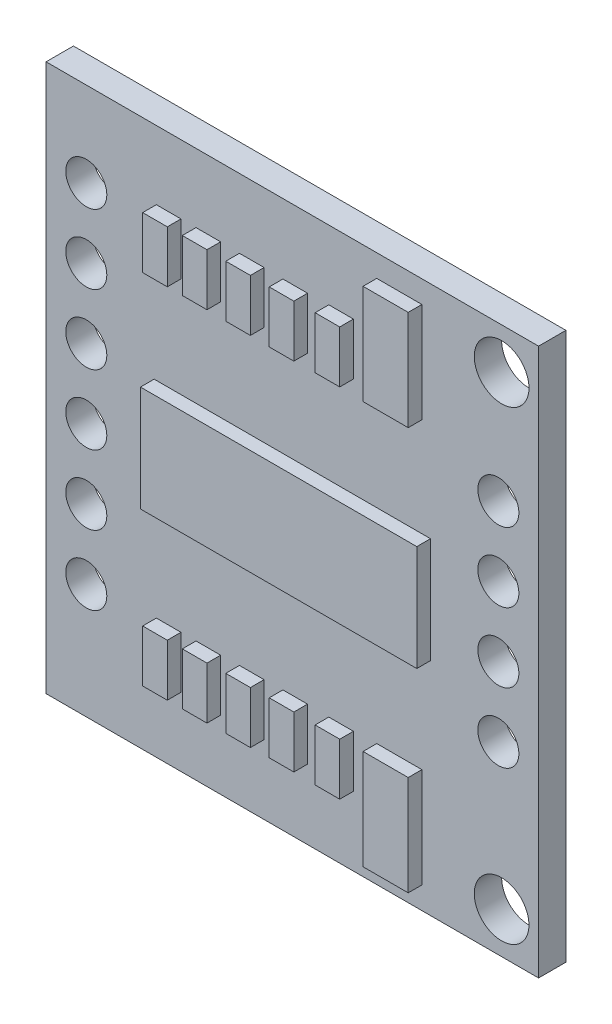
from build123d import *

# Parameters (mm, degrees)
SKETCH1_W           = 18
SKETCH1_H           = 20
SKETCH1_R           = 1
BOSS_EXTRUDE1_DEPTH = 1
SKETCH2_R           = 0.75
CUT_EXTRUDE1_DEPTH  = 1
SKETCH3_W           = 10.1
SKETCH3_H           = 3.86
BOSS_EXTRUDE3_DEPTH = 0.5
SKETCH4_W           = 0.9
SKETCH4_H           = 1.9
SKETCH4_W_2         = 1.65
SKETCH4_H_2         = 3.65
BOSS_EXTRUDE4_DEPTH = 0.5


with BuildPart() as part:
    # Sketch1 → Boss-Extrude1 (new body)
    with BuildSketch(Plane.XY):
        Rectangle(SKETCH1_W, SKETCH1_H)
        with Locations((7.65, 8.5)):
            Circle(SKETCH1_R, mode=Mode.SUBTRACT)
        with Locations(Location((7.65, -8.5, 0), (0, 0, 180))):
            Circle(SKETCH1_R, mode=Mode.SUBTRACT)
    extrude(amount=BOSS_EXTRUDE1_DEPTH)

    # Sketch2 → Cut-Extrude1 (cut)
    with BuildSketch(Plane.XY.offset(1)):
        with Locations((-7.53, 6.9)):
            Circle(SKETCH2_R)
        with Locations((-7.53, 4.36)):
            Circle(SKETCH2_R)
        with Locations((-7.53, 1.82)):
            Circle(SKETCH2_R)
        with Locations((-7.53, -0.72)):
            Circle(SKETCH2_R)
        with Locations((-7.53, -3.26)):
            Circle(SKETCH2_R)
        with Locations((-7.53, -5.8)):
            Circle(SKETCH2_R)
        with Locations(Location((7.53, -3.26, 0), (0, 0, 180))):
            Circle(SKETCH2_R)
        with Locations(Location((7.53, -0.72, 0), (0, 0, 180))):
            Circle(SKETCH2_R)
        with Locations(Location((7.53, 1.82, 0), (0, 0, 180))):
            Circle(SKETCH2_R)
        with Locations(Location((7.53, 4.36, 0), (0, 0, 180))):
            Circle(SKETCH2_R)
    extrude(amount=-CUT_EXTRUDE1_DEPTH, mode=Mode.SUBTRACT)

    # Sketch3 → Boss-Extrude3 (add)
    with BuildSketch(Plane.XY.offset(1)):
        Rectangle(SKETCH3_W, SKETCH3_H)
    extrude(amount=BOSS_EXTRUDE3_DEPTH)

    # Sketch4 → Boss-Extrude4 (add)
    with BuildSketch(Plane.XY.offset(1)):
        with Locations((-4.519825255, 6.542108994)):
            Rectangle(SKETCH4_W, SKETCH4_H)
        with Locations((-3.070068301, 6.542108994)):
            Rectangle(SKETCH4_W, SKETCH4_H)
        with Locations((-1.482219023, 6.522505917)):
            Rectangle(SKETCH4_W, SKETCH4_H)
        with Locations((0.105630256, 6.502902839)):
            Rectangle(SKETCH4_W, SKETCH4_H)
        with Locations((1.782648632, 6.524274443)):
            Rectangle(SKETCH4_W, SKETCH4_H)
        with Locations((3.910298039, 7.361938069)):
            Rectangle(SKETCH4_W_2, SKETCH4_H_2)
        with Locations((3.910298039, -7.361938069)):
            Rectangle(SKETCH4_W_2, SKETCH4_H_2)
        with Locations((1.782648632, -6.524274443)):
            Rectangle(SKETCH4_W, SKETCH4_H)
        with Locations((0.105630256, -6.502902839)):
            Rectangle(SKETCH4_W, SKETCH4_H)
        with Locations((-1.482219023, -6.522505917)):
            Rectangle(SKETCH4_W, SKETCH4_H)
        with Locations((-3.070068301, -6.542108994)):
            Rectangle(SKETCH4_W, SKETCH4_H)
        with Locations((-4.519825255, -6.542108994)):
            Rectangle(SKETCH4_W, SKETCH4_H)
    extrude(amount=BOSS_EXTRUDE4_DEPTH)


solid = part.part
